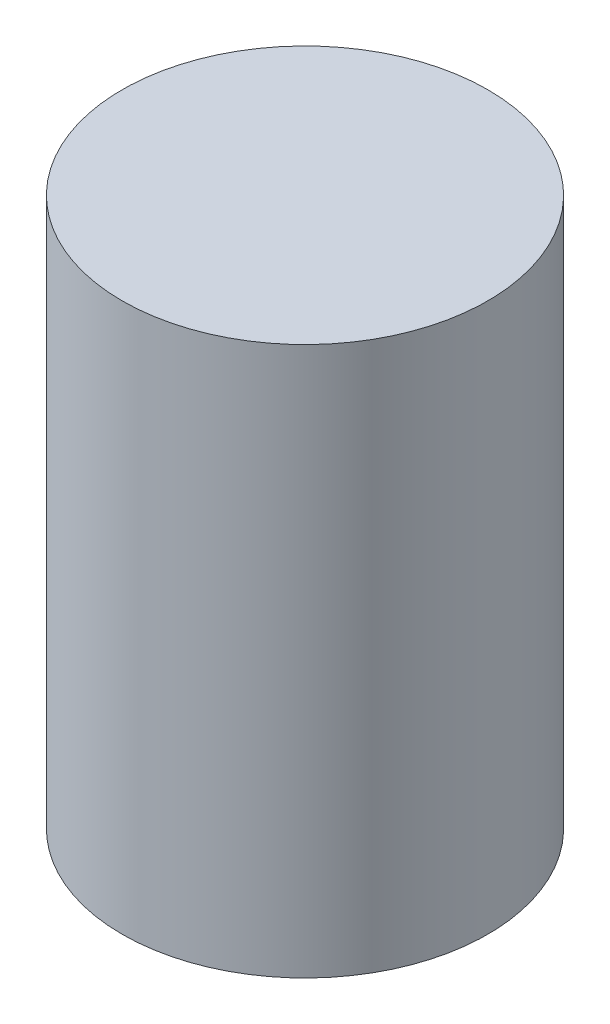
from build123d import *

# Parameters (mm, degrees)
SKETCH1_R           = 12.7
BOSS_EXTRUDE1_DEPTH = 38.1


with BuildPart() as part:
    # Sketch1 → Boss-Extrude1 (new body)
    with BuildSketch(Plane(origin=(0, 0, 0), x_dir=(1, 0, 0), z_dir=(0, 1, 0))):
        with Locations(Location((0, 0, 0), (0, 0, 90))):
            Circle(SKETCH1_R)
    extrude(amount=BOSS_EXTRUDE1_DEPTH)


solid = part.part
